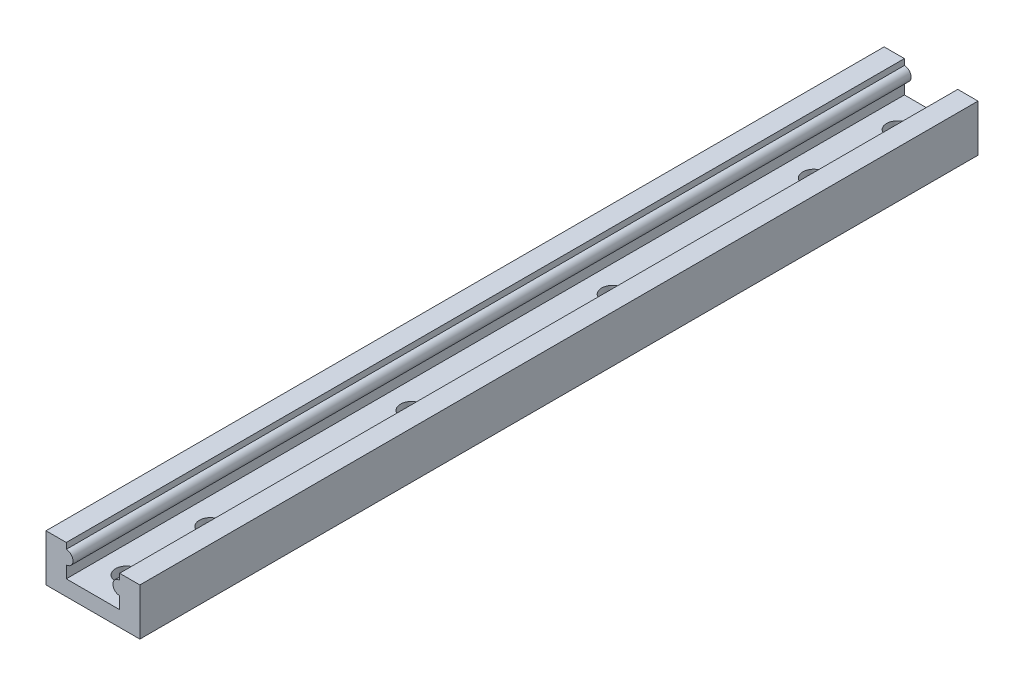
from build123d import *

# Parameters (mm, degrees)
EXTRUDE_1_DEPTH     = 250
SKETCH_2_R          = 1.75
SKETCH_2_R_2        = 1.6
CUT_EXTRUDE_1_DEPTH = 252.352407907
SKETCH_3_R          = 3.25
CUT_EXTRUDE_2_DEPTH = 3


with BuildPart() as part:
    # 草图1 → 凸台-拉伸1 (new body)
    with BuildSketch(Plane.XY):
        with BuildLine():
            Line((-6.044750958, 8.167376983), (0, 8.167376983))
            Line((0, 8.167376983), (0, 6.376329748))
            ThreePointArc((0, 6.376329748), (2, 4.376329748), (0, 2.376329748))
            Line((0, 2.376329748), (0, -1.232623017))
            Line((0, -1.232623017), (15.910498084, -1.232623017))
            Line((15.910498084, -1.232623017), (15.910498084, 2.376329748))
            ThreePointArc((15.910498084, 2.376329748), (13.910498084, 4.376329748), (15.910498084, 6.376329748))
            Line((15.910498084, 6.376329748), (15.910498084, 8.167376983))
            Line((15.910498084, 8.167376983), (21.955249042, 8.167376983))
            Line((21.955249042, 8.167376983), (21.955249042, -5.832623017))
            Line((21.955249042, -5.832623017), (-6.044750958, -5.832623017))
            Line((-6.044750958, -5.832623017), (-6.044750958, 8.167376983))
        make_face()
    extrude(amount=EXTRUDE_1_DEPTH)

    # 草图2 → 切除-拉伸1 (cut, through all)
    with BuildSketch(Plane.XZ.offset(5.832623017)):
        with Locations((7.955249042, 215)):
            Circle(SKETCH_2_R)
        with Locations((7.955249042, 155)):
            Circle(SKETCH_2_R)
        with Locations((7.955249042, 95)):
            Circle(SKETCH_2_R)
        with Locations((7.955249042, 35)):
            Circle(SKETCH_2_R)
        with Locations((7.955249042, -25)):
            Circle(SKETCH_2_R)
        with Locations((7.955249042, -85)):
            Circle(SKETCH_2_R)
        with Locations((7.955249042, 10)):
            Circle(SKETCH_2_R_2)
        with Locations((7.955249042, 240)):
            Circle(SKETCH_2_R_2)
    extrude(amount=-CUT_EXTRUDE_1_DEPTH, mode=Mode.SUBTRACT)

    # 草图3 → 切除-拉伸2 (cut)
    with BuildSketch(Plane(origin=(0, -1.232623017, 0), x_dir=(1, 0, 0), z_dir=(0, 1, 0))):
        with Locations(Location((7.955249042, -35, 0), (0, 0, 270))):
            Circle(SKETCH_3_R)
        with Locations(Location((7.955249042, -95, 0), (0, 0, 270))):
            Circle(SKETCH_3_R)
        with Locations(Location((7.955249042, -155, 0), (0, 0, 270))):
            Circle(SKETCH_3_R)
        with Locations(Location((7.955249042, -215, 0), (0, 0, 270))):
            Circle(SKETCH_3_R)
        with Locations((7.955249042, -275)):
            Circle(SKETCH_3_R)
        with Locations(Location((7.955249042, -240, 0), (0, 0, 270))):
            Circle(SKETCH_3_R)
        with Locations(Location((7.955249042, -10, 0), (0, 0, 270))):
            Circle(SKETCH_3_R)
    extrude(amount=-CUT_EXTRUDE_2_DEPTH, mode=Mode.SUBTRACT)


solid = part.part
